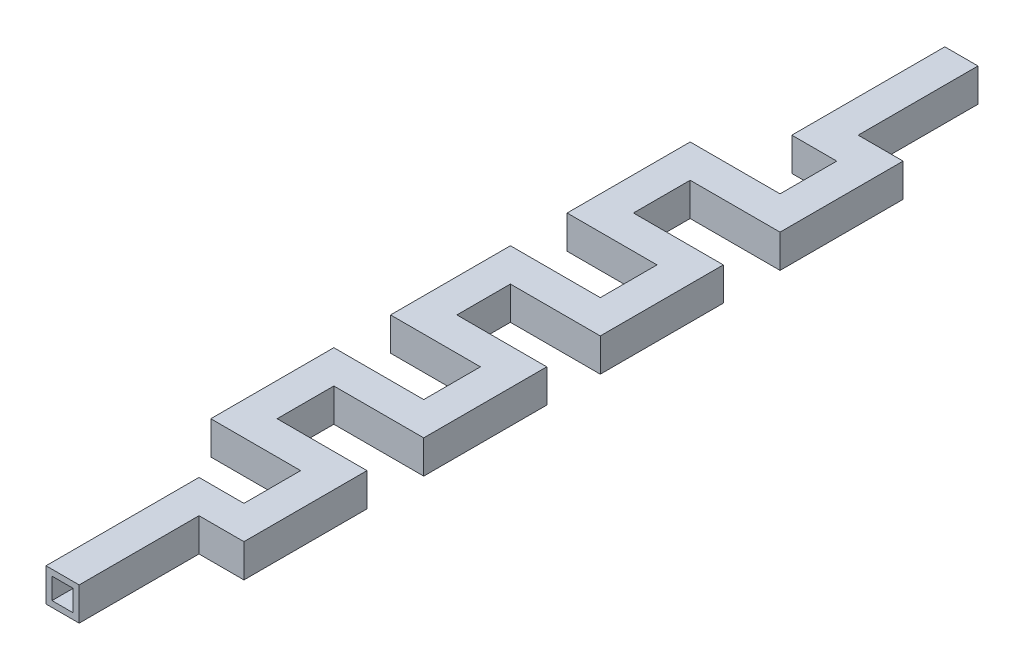
from build123d import *

# Parameters (mm, degrees)
SKETCH3_W            = 2.76715
SKETCH3_H            = 2.76715
BOSS_EXTRUDE1_DEPTH  = 5
SKETCH4_W            = 2.76715
SKETCH4_H            = 2.76715
BOSS_EXTRUDE2_DEPTH  = 7.5
SKETCH5_W            = 2.76715
SKETCH5_H            = 2.76715
BOSS_EXTRUDE3_DEPTH  = 7.5
SKETCH6_W            = 2.76715
SKETCH6_H            = 2.76715
BOSS_EXTRUDE4_DEPTH  = 7.5
SKETCH7_W            = 2.76715
SKETCH7_H            = 2.76715
BOSS_EXTRUDE5_DEPTH  = 7.5
SKETCH8_W            = 2.76715
SKETCH8_H            = 2.76715
BOSS_EXTRUDE6_DEPTH  = 7.5
SKETCH9_W            = 2.76715
SKETCH9_H            = 2.76715
BOSS_EXTRUDE7_DEPTH  = 7.5
SKETCH10_W           = 2.76715
SKETCH10_H           = 2.76715
BOSS_EXTRUDE8_DEPTH  = 7.5
SKETCH11_W           = 2.76715
SKETCH11_H           = 2.76715
BOSS_EXTRUDE9_DEPTH  = 7.5
SKETCH12_W           = 2.76715
SKETCH12_H           = 2.76715
BOSS_EXTRUDE10_DEPTH = 7.5
SKETCH13_W           = 2.76715
SKETCH13_H           = 2.76715
BOSS_EXTRUDE11_DEPTH = 3.75
SKETCH14_W           = 2.76715
SKETCH14_H           = 2.76715
BOSS_EXTRUDE12_DEPTH = 10
SKETCH15_W           = 2.76715
SKETCH15_H           = 2.76715
BOSS_EXTRUDE13_DEPTH = 7.5
SKETCH16_W           = 2.76715
SKETCH16_H           = 2.76715
BOSS_EXTRUDE14_DEPTH = 3.75
SKETCH17_W           = 2.76715
SKETCH17_H           = 2.76715
BOSS_EXTRUDE15_DEPTH = 10
CUT_EXTRUDE3_START   = -0.5
CUT_EXTRUDE3_DEPTH   = 1.76715


with BuildPart() as part:
    # Sketch3 → Boss-Extrude1 (new, symmetric)
    with BuildSketch(Plane.XY):
        Rectangle(SKETCH3_W, SKETCH3_H)
    extrude(amount=BOSS_EXTRUDE1_DEPTH, both=True)

    # Sketch4 → Boss-Extrude2 (add)
    with BuildSketch(Plane(origin=(1.383575, 0, 0), x_dir=(0, 0, -1), z_dir=(1, 0, 0))):
        with Locations((-3.616425, 0)):
            Rectangle(SKETCH4_W, SKETCH4_H)
        with Locations((3.616425, 0)):
            Rectangle(SKETCH4_W, SKETCH4_H)
    extrude(amount=BOSS_EXTRUDE2_DEPTH)

    # Sketch5 → Boss-Extrude3 (add)
    with BuildSketch(Plane.XY.offset(5)):
        with Locations((7.5, 0)):
            Rectangle(SKETCH5_W, SKETCH5_H)
    extrude(amount=BOSS_EXTRUDE3_DEPTH)

    # Sketch6 → Boss-Extrude4 (add)
    with BuildSketch(Plane.ZY.offset(-6.116425)):
        with Locations((11.116425, 0)):
            Rectangle(SKETCH6_W, SKETCH6_H)
    extrude(amount=BOSS_EXTRUDE4_DEPTH)

    # Sketch7 → Boss-Extrude5 (add)
    with BuildSketch(Plane.XY.offset(12.5)):
        Rectangle(SKETCH7_W, SKETCH7_H)
    extrude(amount=BOSS_EXTRUDE5_DEPTH)

    # Sketch8 → Boss-Extrude6 (add)
    with BuildSketch(Plane(origin=(0, 0, -5), x_dir=(-1, 0, 0), z_dir=(0, 0, -1))):
        with Locations((-7.5, 0)):
            Rectangle(SKETCH8_W, SKETCH8_H)
    extrude(amount=BOSS_EXTRUDE6_DEPTH)

    # Sketch9 → Boss-Extrude7 (add)
    with BuildSketch(Plane.ZY.offset(-6.116425)):
        with Locations((-11.116425, 0)):
            Rectangle(SKETCH9_W, SKETCH9_H)
    extrude(amount=BOSS_EXTRUDE7_DEPTH)

    # Sketch10 → Boss-Extrude8 (add)
    with BuildSketch(Plane(origin=(0, 0, -12.5), x_dir=(-1, 0, 0), z_dir=(0, 0, -1))):
        Rectangle(SKETCH10_W, SKETCH10_H)
    extrude(amount=BOSS_EXTRUDE8_DEPTH)

    # Sketch11 → Boss-Extrude9 (add)
    with BuildSketch(Plane(origin=(1.383575, 0, 0), x_dir=(0, 0, -1), z_dir=(1, 0, 0))):
        with Locations((18.616425, 0)):
            Rectangle(SKETCH11_W, SKETCH11_H)
        with Locations((-18.616425, 0)):
            Rectangle(SKETCH11_W, SKETCH11_H)
    extrude(amount=BOSS_EXTRUDE9_DEPTH)

    # Sketch12 → Boss-Extrude10 (add)
    with BuildSketch(Plane(origin=(0, 0, -20), x_dir=(-1, 0, 0), z_dir=(0, 0, -1))):
        with Locations((-7.5, 0)):
            Rectangle(SKETCH12_W, SKETCH12_H)
    extrude(amount=BOSS_EXTRUDE10_DEPTH)

    # Sketch13 → Boss-Extrude11 (add)
    with BuildSketch(Plane.ZY.offset(-6.116425)):
        with Locations((-26.116425, 0)):
            Rectangle(SKETCH13_W, SKETCH13_H)
    extrude(amount=BOSS_EXTRUDE11_DEPTH)

    # Sketch14 → Boss-Extrude12 (add)
    with BuildSketch(Plane(origin=(0, 0, -27.5), x_dir=(-1, 0, 0), z_dir=(0, 0, -1))):
        with Locations((-3.75, 0)):
            Rectangle(SKETCH14_W, SKETCH14_H)
    extrude(amount=BOSS_EXTRUDE12_DEPTH)

    # Sketch15 → Boss-Extrude13 (add)
    with BuildSketch(Plane.XY.offset(20)):
        with Locations((7.5, 0)):
            Rectangle(SKETCH15_W, SKETCH15_H)
    extrude(amount=BOSS_EXTRUDE13_DEPTH)

    # Sketch16 → Boss-Extrude14 (add)
    with BuildSketch(Plane.ZY.offset(-6.116425)):
        with Locations((26.116425, 0)):
            Rectangle(SKETCH16_W, SKETCH16_H)
    extrude(amount=BOSS_EXTRUDE14_DEPTH)

    # Sketch17 → Boss-Extrude15 (add)
    with BuildSketch(Plane.XY.offset(27.5)):
        with Locations((3.75, 0)):
            Rectangle(SKETCH17_W, SKETCH17_H)
    extrude(amount=BOSS_EXTRUDE15_DEPTH)

    # Sketch23 → Cut-Extrude3 (cut)
    with BuildSketch(Plane(origin=(0, 1.383575, 0), x_dir=(1, 0, 0), z_dir=(0, 1, 0)).offset(CUT_EXTRUDE3_START)):
        Polygon((2.866425, 37.5), (4.633575, 37.5), (4.633575, 27), (8.383575, 27), (8.383575, 17.73285), (0.883575, 17.73285), (0.883575, 12), (8.383575, 12), (8.383575, 2.73285), (0.883575, 2.73285), (0.883575, -2.73285), (8.383575, -2.73285), (8.383575, -12), (0.883575, -12), (0.883575, -17.73285), (8.383575, -17.73285), (8.383575, -27), (4.633575, -27), (4.633575, -37.5), (2.866425, -37.5), (2.866425, -25.23285), (6.616425, -25.23285), (6.616425, -19.5), (-0.883575, -19.5), (-0.883575, -10.23285), (6.616425, -10.23285), (6.616425, -4.5), (-0.883575, -4.5), (-0.883575, 4.5), (6.616425, 4.5), (6.616425, 10.23285), (-0.883575, 10.23285), (-0.883575, 19.5), (6.616425, 19.5), (6.616425, 25.23285), (2.866425, 25.23285), align=None)
    extrude(amount=-CUT_EXTRUDE3_DEPTH, mode=Mode.SUBTRACT)


solid = part.part
